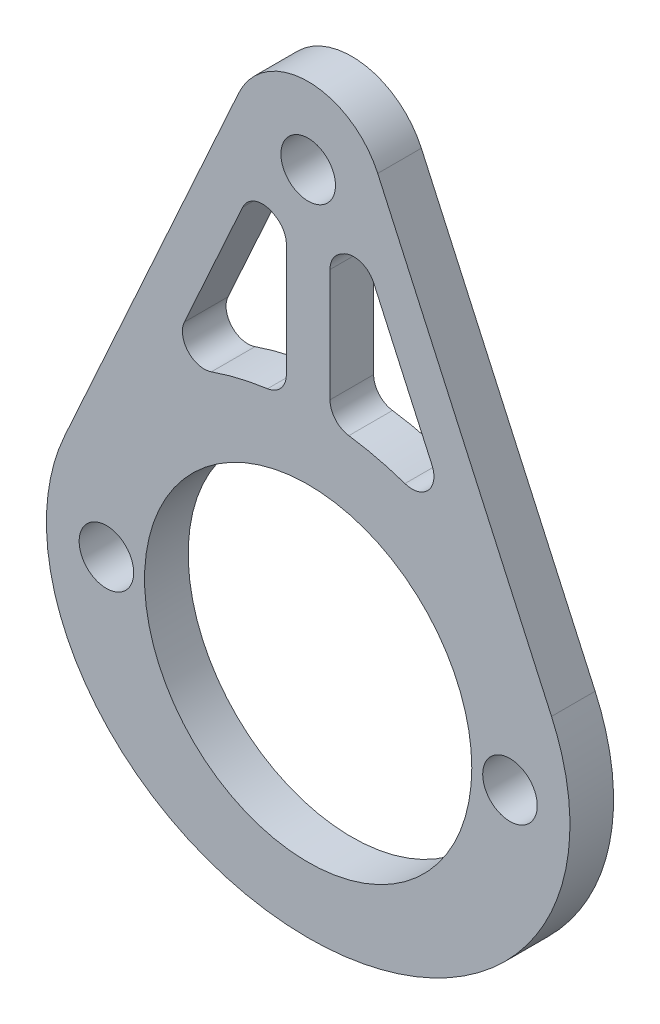
from build123d import *

# Parameters (mm, degrees)
SKETCH_1_R          = 7.5
SKETCH_1_R_2        = 1
EXTRUDE_1_DEPTH     = 2
HOLE_WIZARD_M3_1_D  = 2.5
CUT_EXTRUDE_1_DEPTH = 27.462237387
FILLET_1_R          = 1
HOLE_WIZARD_M3_2_D  = 2.5


with BuildPart() as part:
    # ｽｹｯﾁ1 → ﾎﾞｽ - 押し出し1 (new body)
    with BuildSketch(Plane.XY):
        with BuildLine():
            Line((-11.154481221, 3.871570833), (-3.187731553, 21.445118523))
            ThreePointArc((-3.187731553, 21.445118523), (0, 23.5), (3.187731553, 21.445118523))
            Line((3.187731553, 21.445118523), (11.154481221, 3.871570833))
            add(Edge.make_bspline(
                [(-11.154481221, 3.871570833), (-17.669654434, -10.5), (0, -10.5), (17.669654434, -10.5), (11.154481221, 3.871570833)],
                knots=[2.763959924, 2.763959924, 2.763959924, 4.71238898, 4.71238898, 6.660818037, 6.660818037, 6.660818037], degree=2, weights=[1, 0.561818017, 1, 0.561818017, 1]))
        make_face()
        Circle(SKETCH_1_R, mode=Mode.SUBTRACT)
        with Locations((9.25, 0)):
            Circle(SKETCH_1_R_2, mode=Mode.SUBTRACT)
        with Locations(Location((-9.25, 0, 0), (0, 0, 180))):
            Circle(SKETCH_1_R_2, mode=Mode.SUBTRACT)
    extrude(amount=EXTRUDE_1_DEPTH)

    # M3 ねじ穴1 (through all)
    with Locations(Plane(origin=(0, 0, 0), x_dir=(-1, 0, 0), z_dir=(0, 0, -1))):
        with Locations((-9.25, 0), (9.25, 0)):
            Hole(HOLE_WIZARD_M3_1_D / 2)

    # ｽｹｯﾁ4 → ｶｯﾄ - 押し出し1 (cut, through all)
    with BuildSketch(Plane(origin=(0, 0, 0), x_dir=(-1, 0, 0), z_dir=(0, 0, -1))):
        with BuildLine():
            add(Edge.make_bspline(
                [(-1, 10.46347815), (-4.16749896, 10.231708527), (-6.788544403, 8.658330147)],
                knots=[4.815793199, 4.815793199, 4.815793199, 5.366803847, 5.366803847, 5.366803847], degree=2, weights=[0.948327675, 0.816994665, 0.75323278]))
            Line((-1, 10.46347815), (-1, 17.171572875))
            ThreePointArc((-1, 17.171572875), (-1.8024704, 17.601854788), (-2.438892968, 18.253059506))
            Line((-2.438892968, 18.253059506), (-6.788544403, 8.658330147))
        make_face()
        with BuildLine():
            Line((1, 17.171572875), (1, 10.46347815))
            add(Edge.make_bspline(
                [(6.788544403, 8.658330147), (4.16749896, 10.231708527), (1, 10.46347815)],
                knots=[4.057974114, 4.057974114, 4.057974114, 4.608984762, 4.608984762, 4.608984762], degree=2, weights=[0.75323278, 0.816994665, 0.948327675]))
            Line((6.788544403, 8.658330147), (2.438892968, 18.253059506))
            ThreePointArc((2.438892968, 18.253059506), (1.8024704, 17.601854788), (1, 17.171572875))
        make_face()
    extrude(amount=-CUT_EXTRUDE_1_DEPTH, mode=Mode.SUBTRACT)

    # ﾌｨﾚｯﾄ1
    fillet_1_edges = [part.edges().sort_by_distance(p)[0] for p in [
        (-1, 17.171572875, 1),
        (-2.438892968, 18.253059506, 1),
        (-6.788544403, 8.658330147, 1),
        (2.438892968, 18.253059506, 1),
        (1, 17.171572875, 1),
        (1, 10.46347815, 1),
        (6.788544403, 8.658330147, 1),
        (-1, 10.46347815, 1),
    ]]
    fillet(fillet_1_edges, radius=FILLET_1_R)

    # M3 ねじ穴2 (through all)
    with Locations(Plane.XY.offset(2)):
        with Locations((0, 20)):
            Hole(HOLE_WIZARD_M3_2_D / 2)


solid = part.part
